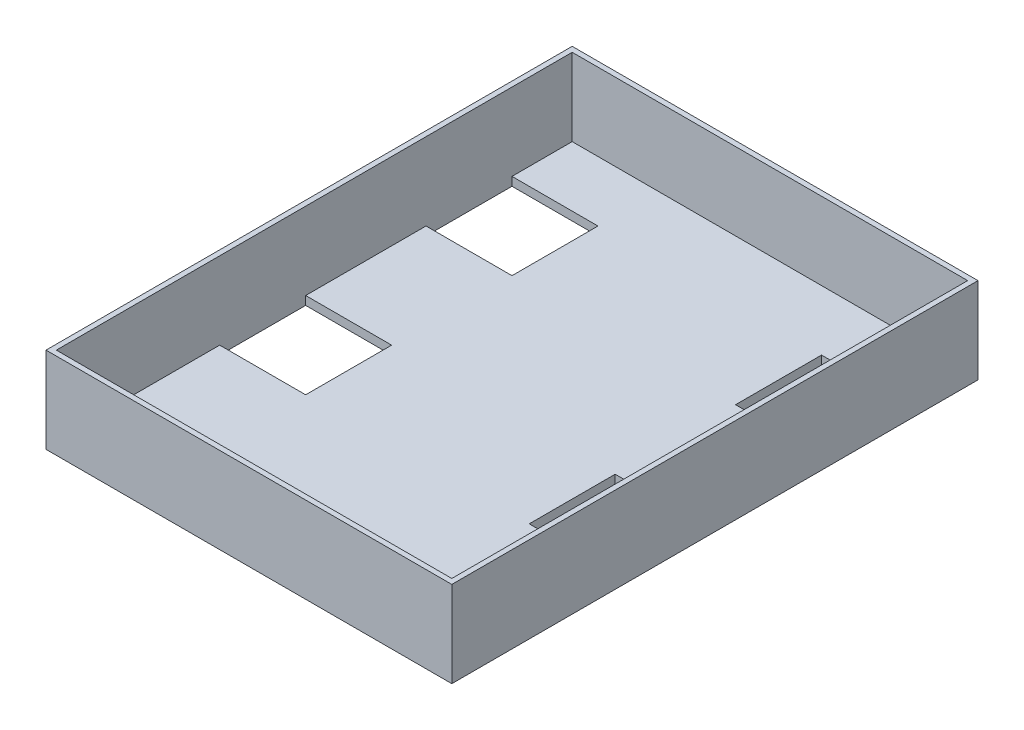
from build123d import *

# Parameters (mm, degrees)
BOSS_EXTRUDE1_DEPTH = 5
SKETCH2_W           = 236
SKETCH2_H           = 306
SKETCH2_W_2         = 230
SKETCH2_H_2         = 300
BOSS_EXTRUDE2_DEPTH = 50


with BuildPart() as part:
    # Sketch1 → Boss-Extrude1 (new body)
    with BuildSketch(Plane(origin=(0, 0, 0), x_dir=(1, 0, 0), z_dir=(0, 1, 0))):
        Polygon((-115, 150), (115, 150), (115, 115), (65, 115), (65, 65), (115, 65), (115, -5), (65, -5), (65, -55), (115, -55), (115, -150), (-115, -150), (-115, -55), (-65, -55), (-65, -5), (-115, -5), (-115, 65), (-65, 65), (-65, 115), (-115, 115), align=None)
    extrude(amount=BOSS_EXTRUDE1_DEPTH)

    # Sketch2 → Boss-Extrude2 (add)
    with BuildSketch(Plane(origin=(0, 0, 0), x_dir=(1, 0, 0), z_dir=(0, 1, 0))):
        Rectangle(SKETCH2_W, SKETCH2_H)
        Rectangle(SKETCH2_W_2, SKETCH2_H_2, mode=Mode.SUBTRACT)
    extrude(amount=BOSS_EXTRUDE2_DEPTH)


solid = part.part
